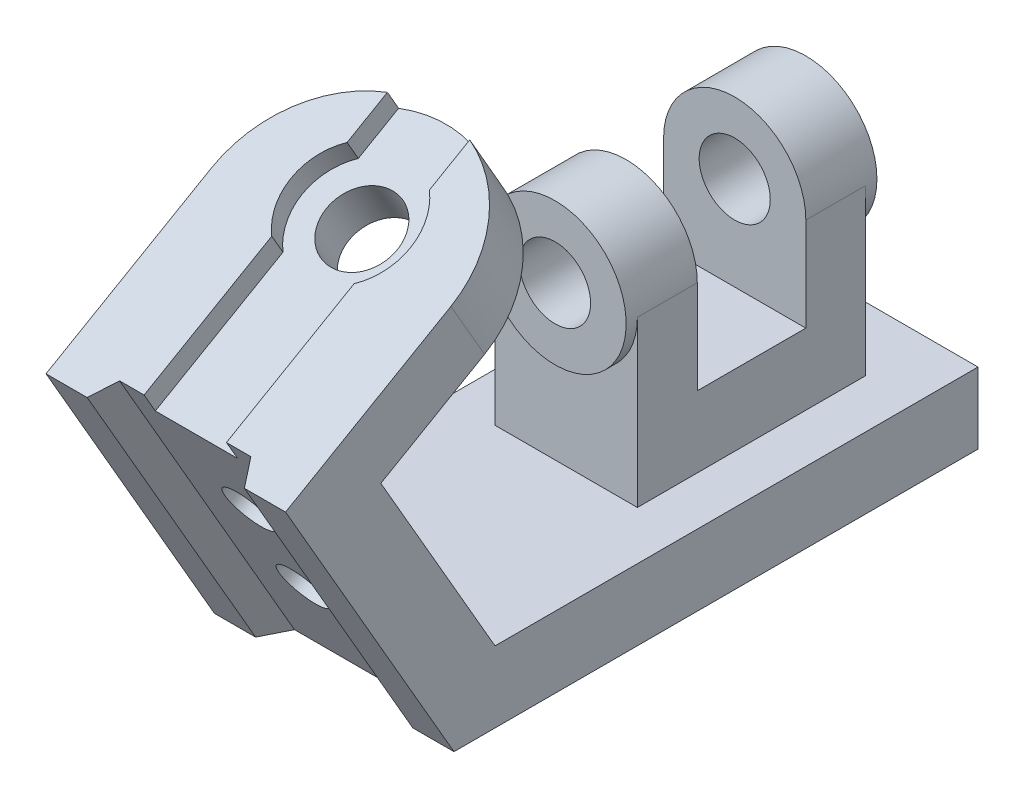
from build123d import *

# Parameters (mm, degrees)
EXTRUDE_THIN1_DEPTH     = 64
BOSS_EXTRUDE1_DEPTH     = 18
SKETCH3_W               = 61
SKETCH3_H               = 44
BOSS_EXTRUDE2_DEPTH     = 19
SKETCH4_W               = 29
SKETCH4_H               = 25
CUT_EXTRUDE1_DEPTH      = 191.964551072
CUT_EXTRUDE2_DEPTH      = 55
CUT_EXTRUDE2_DEPTH_BACK = 204.633149969
SKETCH5_R               = 19
SKETCH6_R               = 19
BOSS_EXTRUDE3_DEPTH     = 19
SKETCH8_R               = 19
BOSS_EXTRUDE4_DEPTH     = 19
SKETCH9_R               = 9.5
CUT_EXTRUDE3_DEPTH      = 171.817035937
CUT_EXTRUDE8_DEPTH      = 211.703583263
SKETCH16_W              = 22
SKETCH16_H              = 80
CUT_EXTRUDE9_DEPTH      = 6
SKETCH17_R              = 16
CUT_EXTRUDE10_DEPTH     = 6
SKETCH18_R              = 9.5
CUT_EXTRUDE11_DEPTH     = 19
SKETCH19_R              = 6.5
CUT_EXTRUDE12_DEPTH     = 19


with BuildPart() as part:
    # Sketch1 → Extrude-Thin1 (new body)
    with BuildSketch(Plane(origin=(0, 0, 0), x_dir=(0, 0, -1), z_dir=(1, 0, 0))):
        Polygon((-45, 77.942286341), (0, 0), (140, 0), (140, 19), (10.969655115, 19), (-28.545517328, 87.442286341), align=None)
    extrude(amount=EXTRUDE_THIN1_DEPTH)

    # Sketch2 → Boss-Extrude1 (add)
    with BuildSketch(Plane(origin=(0, 77.942286341, 45), x_dir=(1, 0, 0), z_dir=(0, 0.8660254037844362, 0.5000000000000046))):
        with BuildLine():
            Line((0, 0), (0, 51))
            ThreePointArc((0, 51), (32, 83), (64, 51))
            Line((64, 51), (64, 0))
            Line((64, 0), (0, 0))
        make_face()
    extrude(amount=-BOSS_EXTRUDE1_DEPTH)

    # Sketch3 → Boss-Extrude2 (add, symmetric)
    with BuildSketch(Plane(origin=(32, 0, 0), x_dir=(0, 0, -1), z_dir=(1, 0, 0))):
        with Locations((92.5, 41)):
            Rectangle(SKETCH3_W, SKETCH3_H)
    extrude(amount=BOSS_EXTRUDE2_DEPTH, both=True)

    # Sketch4 → Cut-Extrude1 (cut, through all)
    with BuildSketch(Plane(origin=(51, 0, 0), x_dir=(0, 0, -1), z_dir=(1, 0, 0))):
        with Locations((92.5, 50.5)):
            Rectangle(SKETCH4_W, SKETCH4_H)
    extrude(amount=-CUT_EXTRUDE1_DEPTH, mode=Mode.SUBTRACT)

    # Sketch5 → Cut-Extrude2 (cut, two sides: drawn at the far end of the back side and taken through both)
    with BuildSketch(Plane.XY.offset(-107).offset(-CUT_EXTRUDE2_DEPTH_BACK)):
        with Locations((32, 63)):
            Circle(SKETCH5_R)
    extrude(amount=CUT_EXTRUDE2_DEPTH + CUT_EXTRUDE2_DEPTH_BACK, mode=Mode.SUBTRACT)

    # Sketch6 → Boss-Extrude3 (add)
    with BuildSketch(Plane.XY.offset(-107)):
        with Locations((32, 63)):
            Circle(SKETCH6_R)
    extrude(amount=-BOSS_EXTRUDE3_DEPTH)

    # Sketch8 → Boss-Extrude4 (add)
    with BuildSketch(Plane(origin=(0, 0, -78), x_dir=(-1, 0, 0), z_dir=(0, 0, -1))):
        with Locations(Location((-32, 63, 0), (0, 0, 180))):
            Circle(SKETCH8_R)
    extrude(amount=-BOSS_EXTRUDE4_DEPTH)

    # Sketch9 → Cut-Extrude3 (cut, through all)
    with BuildSketch(Plane.XY.offset(-59)):
        with Locations((32, 63)):
            Circle(SKETCH9_R)
    extrude(amount=-CUT_EXTRUDE3_DEPTH, mode=Mode.SUBTRACT)

    # Sketch15 → Cut-Extrude8 (cut, through all)
    with BuildSketch(Plane(origin=(0, 77.942286341, 45), x_dir=(1, 0, 0), z_dir=(0, 0.8660254037844362, 0.5000000000000046))):
        Polygon((11, 0), (14.464101615, 6), (49.535898385, 6), (53, 0), align=None)
    extrude(amount=-CUT_EXTRUDE8_DEPTH, mode=Mode.SUBTRACT)

    # Sketch16 → Cut-Extrude9 (cut)
    with BuildSketch(Plane(origin=(0, 77.942286341, 45), x_dir=(1, 0, 0), z_dir=(0, 0.8660254037844362, 0.5000000000000046))):
        with Locations((32.014101615, 46)):
            Rectangle(SKETCH16_W, SKETCH16_H)
    extrude(amount=-CUT_EXTRUDE9_DEPTH, mode=Mode.SUBTRACT)

    # Sketch17 → Cut-Extrude10 (cut)
    with BuildSketch(Plane(origin=(0, 77.942286341, 45), x_dir=(1, 0, 0), z_dir=(0, 0.8660254037844362, 0.5000000000000046))):
        with Locations((32.014101615, 57)):
            Circle(SKETCH17_R)
    extrude(amount=-CUT_EXTRUDE10_DEPTH, mode=Mode.SUBTRACT)

    # Sketch18 → Cut-Extrude11 (cut)
    with BuildSketch(Plane(origin=(0, 72.746133918, 42), x_dir=(1, 0, 0), z_dir=(0, 0.866025403784436, 0.5000000000000047))):
        with Locations(Location((32.014101615, 57, 0), (0, 0, 270))):
            Circle(SKETCH18_R)
    extrude(amount=-CUT_EXTRUDE11_DEPTH, mode=Mode.SUBTRACT)

    # Sketch19 → Cut-Extrude12 (cut)
    with BuildSketch(Plane(origin=(0, 3, -5.196152423), x_dir=(1, 0, 0), z_dir=(0, -0.5000000000000044, 0.8660254037844362))):
        with Locations(Location((32.014101615, 56, 0), (0, 0, 270))):
            Circle(SKETCH19_R)
        with Locations(Location((32.014101615, 27, 0), (0, 0, 270))):
            Circle(SKETCH19_R)
    extrude(amount=-CUT_EXTRUDE12_DEPTH, mode=Mode.SUBTRACT)


solid = part.part
